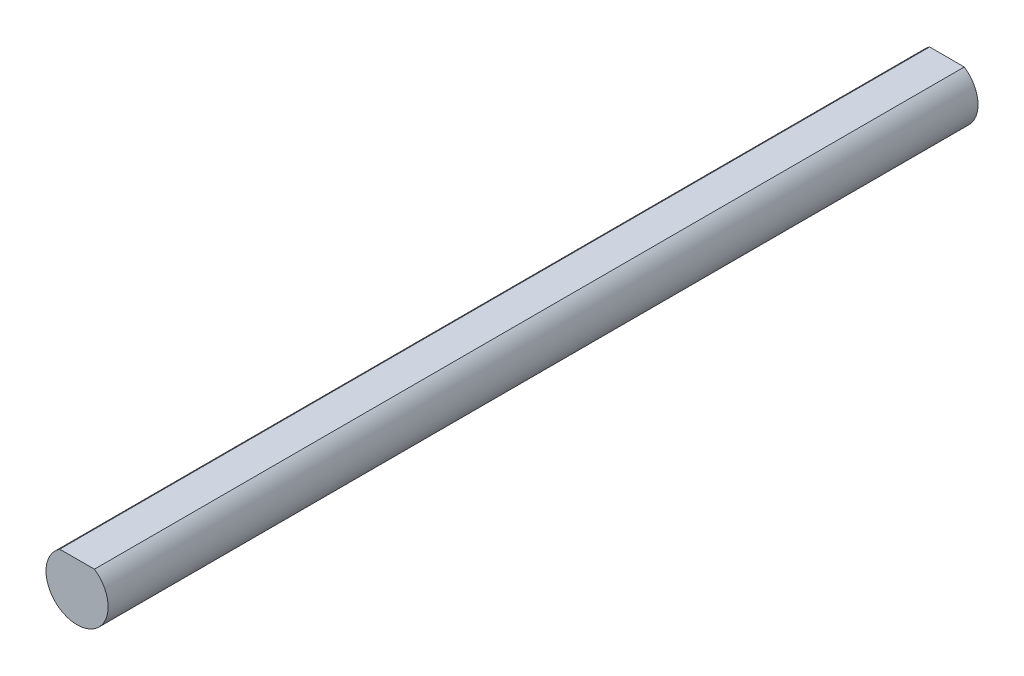
from build123d import *

# Parameters (mm, degrees)
BOSS_EXTRUDE1_DEPTH = 50
CUT_EXTRUDE3_START  = 50
CUT_EXTRUDE3_DEPTH  = 34.214


with BuildPart() as part:
    # Sketch1 → Boss-Extrude1 (new, symmetric)
    with BuildSketch(Plane.XY):
        with BuildLine():
            Line((-1.311487705, 1.95), (1.311487705, 1.95))
            ThreePointArc((1.311487705, 1.95), (0, -2.35), (-1.311487705, 1.95))
        make_face()
    extrude(amount=BOSS_EXTRUDE1_DEPTH, both=True)

    # Sketch1<6> → Cut-Extrude3 (cut)
    with BuildSketch(Plane.XY.offset(CUT_EXTRUDE3_START)):
        with BuildLine():
            Line((-1.311487705, 1.95), (1.311487705, 1.95))
            ThreePointArc((1.311487705, 1.95), (0, -2.35), (-1.311487705, 1.95))
        make_face()
    extrude(amount=-CUT_EXTRUDE3_DEPTH, mode=Mode.SUBTRACT)


solid = part.part
